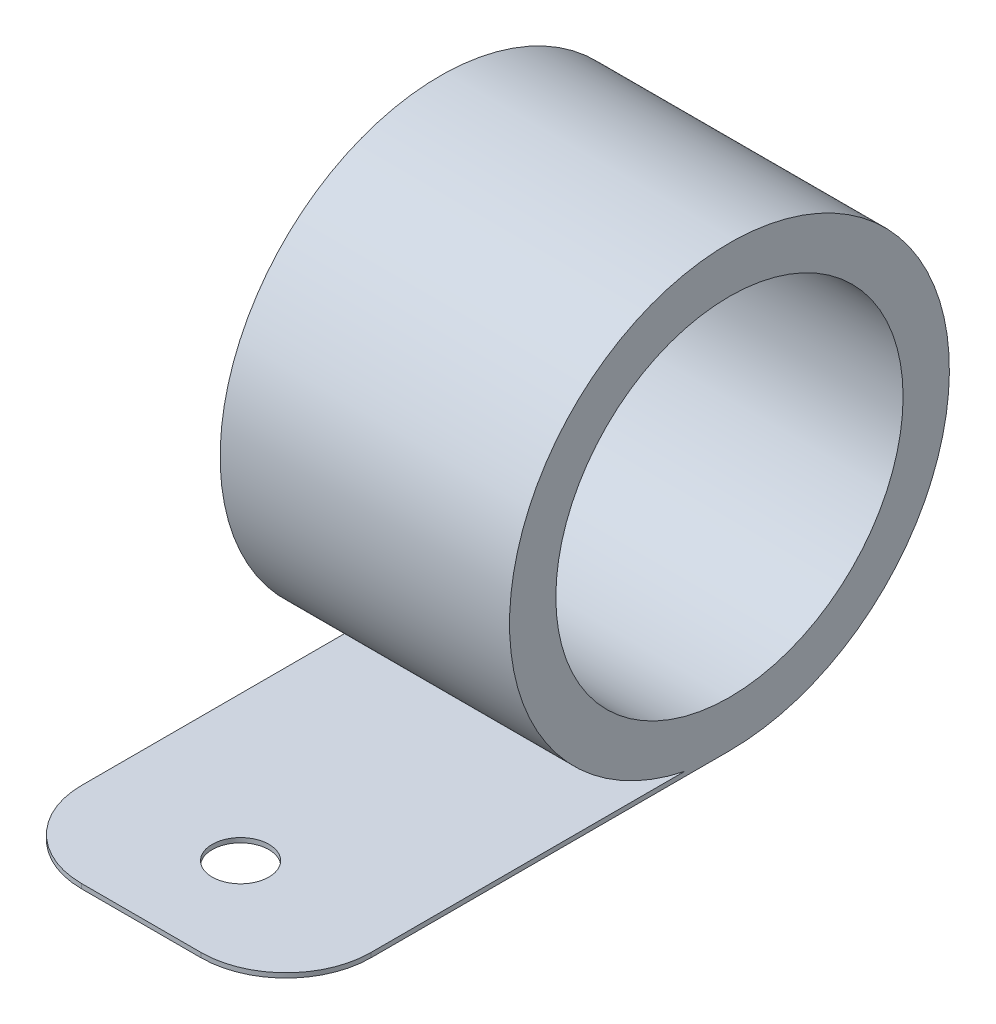
from build123d import *

# Parameters (mm, degrees)
SKETCH1_R               = 19.304
SKETCH1_R_2             = 15.24
BOSS_EXTRUDE1_DEPTH     = 12.7
SKETCH2_W               = 25.4
SKETCH2_H               = 38.923585408
BOSS_EXTRUDE2_DEPTH     = 0.4064
CUT_EXTRUDE1_DEPTH      = 56.997301217
CUT_EXTRUDE1_DEPTH_BACK = 56.997301217
SKETCH3_R               = 2.4892
FILLET1_R               = 7.46


with BuildPart() as part:
    # Sketch1 → Boss-Extrude1 (new, symmetric)
    with BuildSketch(Plane(origin=(0, 0, 0), x_dir=(0, 0, -1), z_dir=(1, 0, 0))):
        Circle(SKETCH1_R)
        Circle(SKETCH1_R_2, mode=Mode.SUBTRACT)
    extrude(amount=BOSS_EXTRUDE1_DEPTH, both=True)

    # Sketch2 → Boss-Extrude2 (add)
    with BuildSketch(Plane(origin=(0, -19.304, 0), x_dir=(1, 0, 0), z_dir=(0, 1, 0))):
        with Locations((0, -19.461792704)):
            Rectangle(SKETCH2_W, SKETCH2_H)
    extrude(amount=BOSS_EXTRUDE2_DEPTH)

    # Sketch3 → Cut-Extrude1 (cut, two sides: drawn at the far end of the back side and taken through both)
    with BuildSketch(Plane(origin=(0, -18.8976, 0), x_dir=(1, 0, 0), z_dir=(0, 1, 0)).offset(-CUT_EXTRUDE1_DEPTH_BACK)):
        with Locations(Location((0, -30.211385408, 0), (0, 0, 270))):
            Circle(SKETCH3_R)
    extrude(amount=CUT_EXTRUDE1_DEPTH + CUT_EXTRUDE1_DEPTH_BACK, mode=Mode.SUBTRACT)

    # Fillet1
    fillet1_edges = [part.edges().sort_by_distance(p)[0] for p in [
        (12.7, -19.1008, 38.923585408),
        (-12.7, -19.1008, 38.923585408),
    ]]
    fillet(fillet1_edges, radius=FILLET1_R)


solid = part.part
